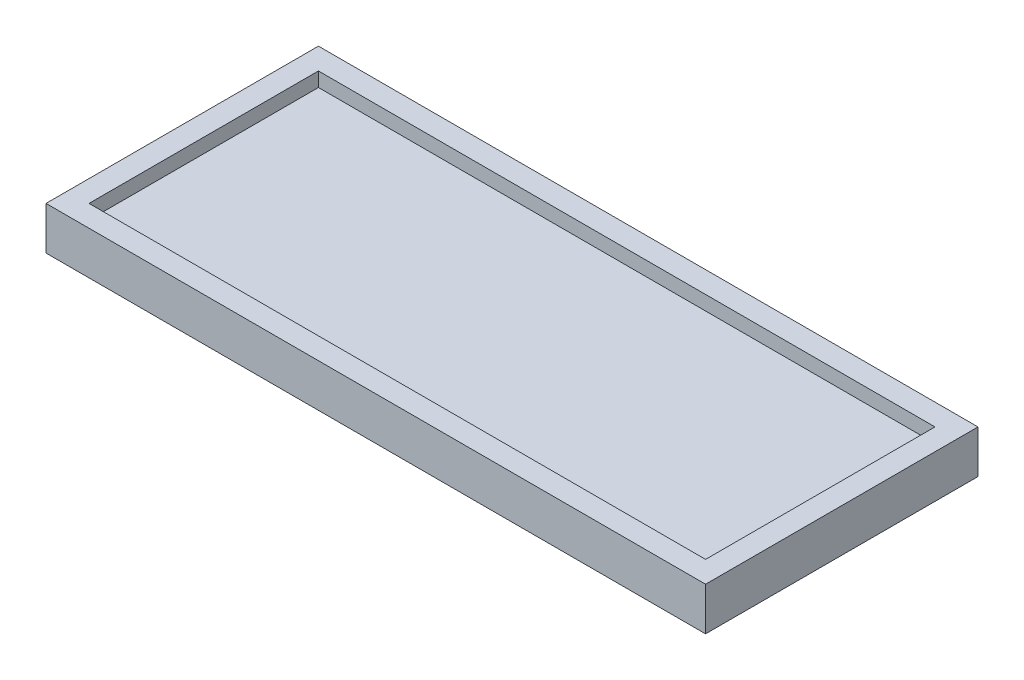
from build123d import *

# Parameters (mm, degrees)
SKETCH1_W           = 43
SKETCH1_H           = 16
BOSS_EXTRUDE1_DEPTH = 2
SKETCH2_W           = 46
SKETCH2_H           = 19
SKETCH2_W_2         = 43
SKETCH2_H_2         = 16
BOSS_EXTRUDE4_DEPTH = 3


with BuildPart() as part:
    # Sketch1 → Boss-Extrude1 (new body)
    with BuildSketch(Plane(origin=(0, 0, 0), x_dir=(1, 0, 0), z_dir=(0, 1, 0))):
        Rectangle(SKETCH1_W, SKETCH1_H)
    extrude(amount=BOSS_EXTRUDE1_DEPTH)

    # Sketch2 → Boss-Extrude4 (add)
    with BuildSketch(Plane.XZ):
        Rectangle(SKETCH2_W, SKETCH2_H)
        Rectangle(SKETCH2_W_2, SKETCH2_H_2, mode=Mode.SUBTRACT)
    extrude(amount=-BOSS_EXTRUDE4_DEPTH)


solid = part.part
